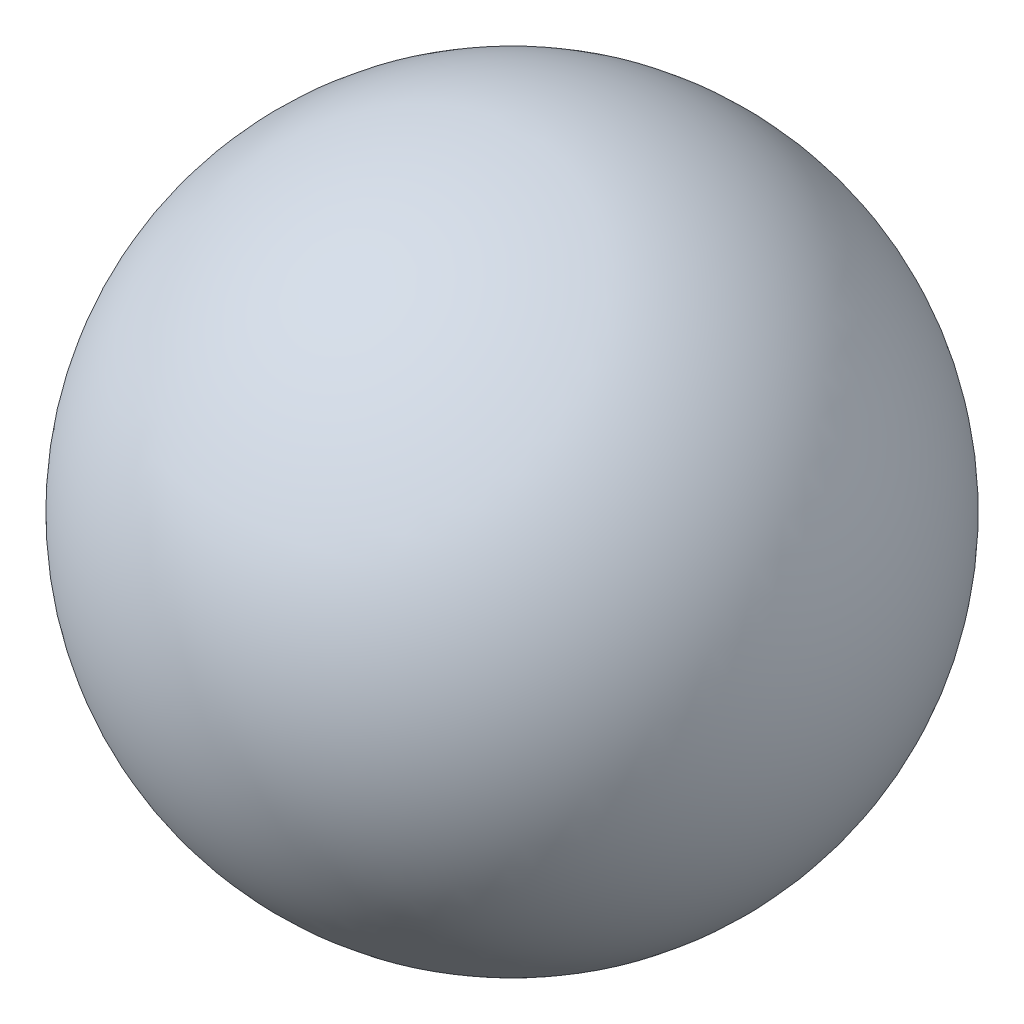
from build123d import *


with BuildPart() as part:
    # Sketch1 → Revolve1 (revolve)
    with BuildSketch(Plane.XY):
        with BuildLine():
            Line((0, 63.5), (0, -63.5))
            ThreePointArc((0, -63.5), (63.5, 0), (0, 63.5))
        make_face()
    revolve(axis=Axis((0, 63.5, 0), (0, -1, 0)))


solid = part.part
